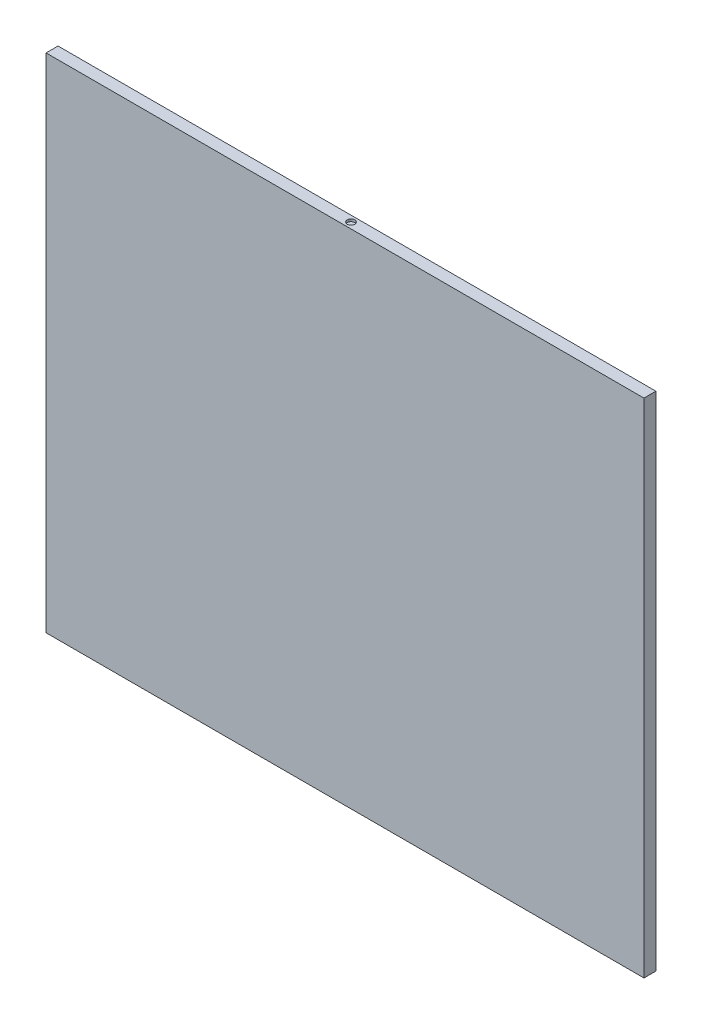
from build123d import *

# Parameters (mm, degrees)
ESQUISSE1_W             = 250
ESQUISSE1_H             = 210
BOSS_EXTRU_1_DEPTH      = 5
ESQUISSE2_R             = 1.587392493
ENL_V_MAT_EXTRU_2_DEPTH = 1


with BuildPart() as part:
    # Esquisse1 → Boss.-Extru.1 (new body)
    with BuildSketch(Plane.XY):
        Rectangle(ESQUISSE1_W, ESQUISSE1_H)
    extrude(amount=BOSS_EXTRU_1_DEPTH)

    # Esquisse2 → Enlèv. mat.-Extru.2 (cut)
    with BuildSketch(Plane(origin=(0, 105, 0), x_dir=(1, 0, 0), z_dir=(0, 1, 0))):
        with Locations(Location((0, -2.5, 0), (0, 0, 270))):
            Circle(ESQUISSE2_R)
    extrude(amount=-ENL_V_MAT_EXTRU_2_DEPTH, mode=Mode.SUBTRACT)


solid = part.part
